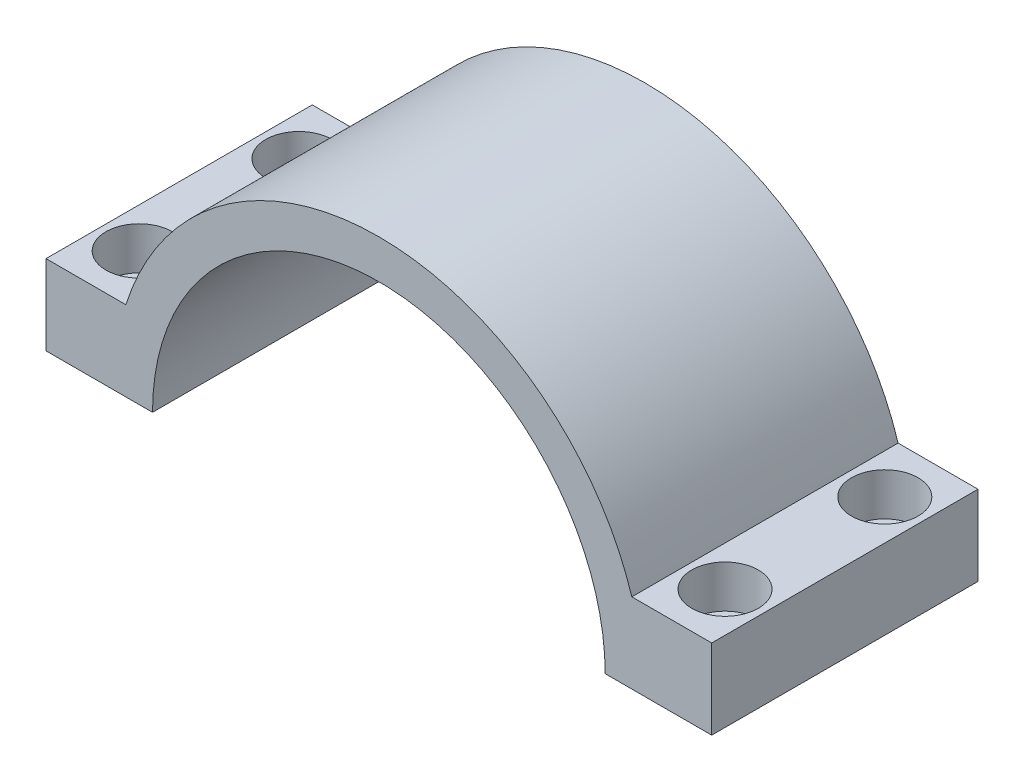
from build123d import *

# Parameters (mm, degrees)
SALIENTE_EXTRUIR1_DEPTH                              = 10
REFRENTADO_PARA_TORNILLO_CON_CABEZA_TRON_D           = 2
REFRENTADO_PARA_TORNILLO_CON_CABEZA_TRON_CBORE_D     = 2.5
REFRENTADO_PARA_TORNILLO_CON_CABEZA_TRON_CBORE_DEPTH = 1.6


with BuildPart() as part:
    # Croquis1 → Saliente-Extruir1 (new body)
    with BuildSketch(Plane.XY):
        with BuildLine():
            ThreePointArc((-9.5, 3), (0, 9.962429423), (9.5, 3))
            Line((9.5, 3), (12.5, 3))
            Line((12.5, 3), (12.5, 0))
            Line((12.5, 0), (8.5, 0))
            ThreePointArc((8.5, 0), (0, 8.5), (-8.5, 0))
            Line((-8.5, 0), (-12.5, 0))
            Line((-12.5, 0), (-12.5, 3))
            Line((-12.5, 3), (-9.5, 3))
        make_face()
    extrude(amount=SALIENTE_EXTRUIR1_DEPTH)

    # Refrentado para tornillo con cabeza troncocónica de M23 (through all)
    with Locations(Plane(origin=(-11, 3, 2), x_dir=(1, 0, 0), z_dir=(0, 1, 0))):
        with Locations((0, 0), (0, -6), (22, 0), (22, -6)):
            CounterBoreHole(REFRENTADO_PARA_TORNILLO_CON_CABEZA_TRON_D / 2, REFRENTADO_PARA_TORNILLO_CON_CABEZA_TRON_CBORE_D / 2, REFRENTADO_PARA_TORNILLO_CON_CABEZA_TRON_CBORE_DEPTH)


solid = part.part
